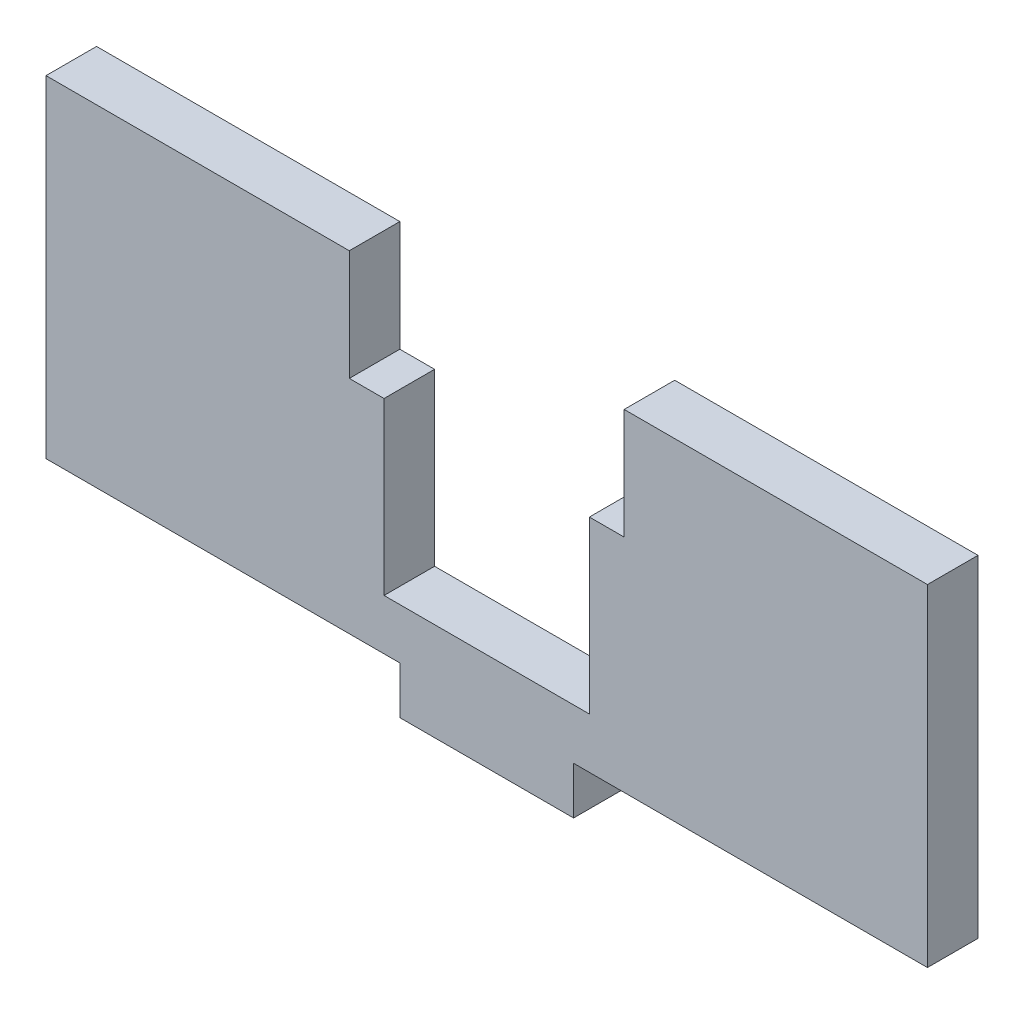
from build123d import *

# Parameters (mm, degrees)
BOSS_EXTRUDE1_DEPTH = 1.6
SKETCH2_W           = 8.7
SKETCH2_H           = 1
CUT_EXTRUDE1_DEPTH  = 1.6
SKETCH3_W           = 9.6
SKETCH3_H           = 1
BOSS_EXTRUDE2_DEPTH = 1.6


with BuildPart() as part:
    # Sketch1 → Boss-Extrude1 (new body)
    with BuildSketch(Plane.XY):
        Polygon((2.75, 0), (-2.75, 0), (-2.75, 1.5), (-13.95, 1.5), (-13.95, 11), (-4.35, 11), (-4.35, 9.5), (-3.25, 9.5), (-3.25, 3.1), (3.25, 3.1), (3.25, 9.5), (4.35, 9.5), (4.35, 11), (13.95, 11), (13.95, 1.5), (2.75, 1.5), align=None)
    extrude(amount=BOSS_EXTRUDE1_DEPTH)

    # Sketch2 → Cut-Extrude1 (cut)
    with BuildSketch(Plane.XY.offset(1.6)):
        with Locations((0, 9)):
            Rectangle(SKETCH2_W, SKETCH2_H)
    extrude(amount=-CUT_EXTRUDE1_DEPTH, mode=Mode.SUBTRACT)

    # Sketch3 → Boss-Extrude2 (add)
    with BuildSketch(Plane.XY.offset(1.6)):
        with Locations((-9.15, 11.5)):
            Rectangle(SKETCH3_W, SKETCH3_H)
        with Locations((9.15, 11.5)):
            Rectangle(SKETCH3_W, SKETCH3_H)
    extrude(amount=-BOSS_EXTRUDE2_DEPTH)


solid = part.part
